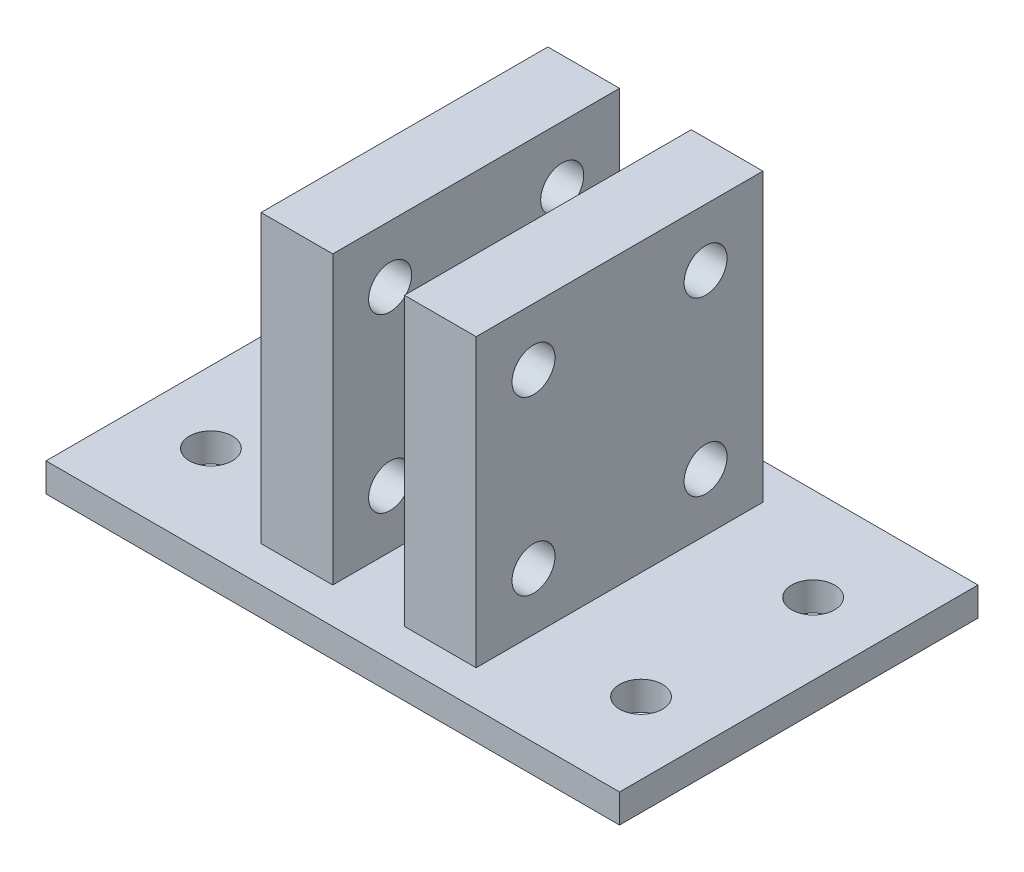
from build123d import *

# Parameters (mm, degrees)
SKETCH_1_W          = 40
SKETCH_1_H          = 25
EXTRUDE_2_DEPTH     = 2
SKETCH_3_W          = 15
SKETCH_3_H          = 20
EXTRUDE_3_DEPTH     = 20
SKETCH_4_W          = 5
SKETCH_4_H          = 20
CUT_EXTRUDE_1_DEPTH = 20
SKETCH_5_R          = 1.5
CUT_EXTRUDE_2_DEPTH = 15
SKETCH_6_R          = 1.5
CUT_EXTRUDE_3_DEPTH = 15


with BuildPart() as part:
    # 草图1 → 凸台-拉伸2 (new body)
    with BuildSketch(Plane(origin=(0, 0, 0), x_dir=(1, 0, 0), z_dir=(0, 1, 0))):
        Rectangle(SKETCH_1_W, SKETCH_1_H)
    extrude(amount=EXTRUDE_2_DEPTH)

    # 草图3 → 凸台-拉伸3 (add)
    with BuildSketch(Plane(origin=(0, 2, 0), x_dir=(1, 0, 0), z_dir=(0, 1, 0))):
        Rectangle(SKETCH_3_W, SKETCH_3_H)
    extrude(amount=EXTRUDE_3_DEPTH)

    # 草图4 → 切除-拉伸1 (cut)
    with BuildSketch(Plane(origin=(0, 22, 0), x_dir=(1, 0, 0), z_dir=(0, 1, 0))):
        Rectangle(SKETCH_4_W, SKETCH_4_H)
    extrude(amount=-CUT_EXTRUDE_1_DEPTH, mode=Mode.SUBTRACT)

    # 草图5 → 切除-拉伸2 (cut)
    with BuildSketch(Plane(origin=(7.5, 0, 0), x_dir=(0, 0, -1), z_dir=(1, 0, 0))):
        with Locations((-6, 18)):
            Circle(SKETCH_5_R)
        with Locations((6, 18)):
            Circle(SKETCH_5_R)
        with Locations((-6, 6)):
            Circle(SKETCH_5_R)
        with Locations((6, 6)):
            Circle(SKETCH_5_R)
    extrude(amount=-CUT_EXTRUDE_2_DEPTH, mode=Mode.SUBTRACT)

    # 草图6 → 切除-拉伸3 (cut)
    with BuildSketch(Plane(origin=(0, 2, 0), x_dir=(1, 0, 0), z_dir=(0, 1, 0))):
        with Locations(Location((-15, 6, 0), (0, 0, 270))):
            Circle(SKETCH_6_R)
        with Locations(Location((-15, -6, 0), (0, 0, 270))):
            Circle(SKETCH_6_R)
        with Locations(Location((15, 6, 0), (0, 0, 270))):
            Circle(SKETCH_6_R)
        with Locations(Location((15, -6, 0), (0, 0, 270))):
            Circle(SKETCH_6_R)
    extrude(amount=-CUT_EXTRUDE_3_DEPTH, mode=Mode.SUBTRACT)


solid = part.part
